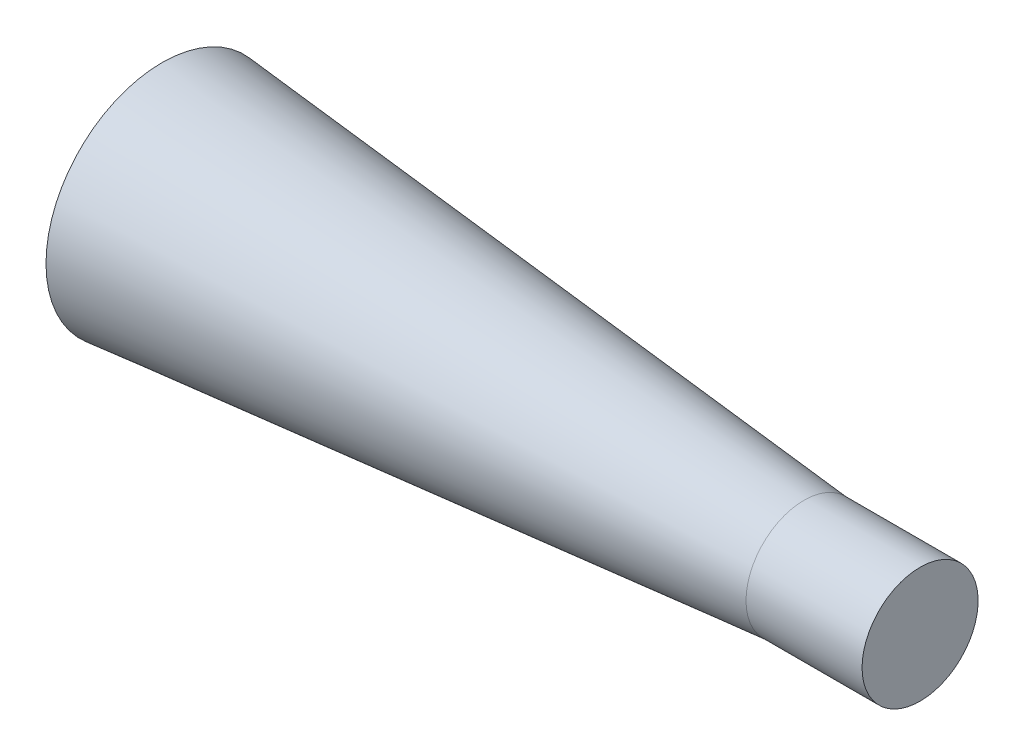
from build123d import *


with BuildPart() as part:
    # Sketch1 → Revolve2 (revolve)
    with BuildSketch(Plane.XY, mode=Mode.PRIVATE) as revolve2_sk:
        with BuildLine():
            ThreePointArc((1.339745962, 5), (0.340741737, 2.588190451), (0, 0))
            Line((0, 0), (34, 0))
            Line((34, 0), (34, 2.5))
            Line((34, 2.5), (29, 2.5))
            Line((29, 2.5), (1.339745962, 5))
        make_face()
    revolve(revolve2_sk.sketch.rotate(Axis((0, 0, 0), (1, 0, 0)), 90), axis=Axis((0, 0, 0), (1, 0, 0)))


solid = part.part
